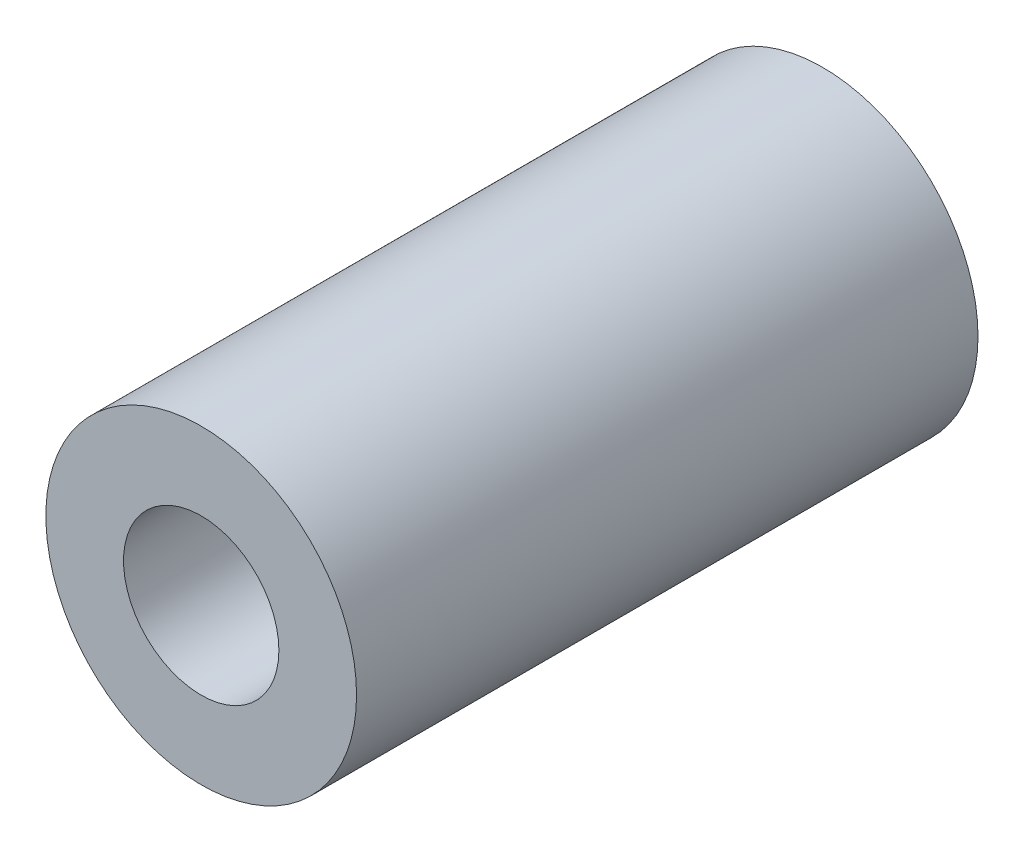
from build123d import *

# Parameters (mm, degrees)
SKETCH1_R               = 6.35
BOSS_EXTRUDE1_DEPTH     = 25.4
CUT_EXTRUDE1_DEPTH      = 27.940768363
CUT_EXTRUDE1_DEPTH_BACK = 27.940768363
SKETCH2_R               = 3.175


with BuildPart() as part:
    # Sketch1 → Boss-Extrude1 (new body)
    with BuildSketch(Plane.XY):
        Circle(SKETCH1_R)
    extrude(amount=BOSS_EXTRUDE1_DEPTH)

    # Sketch2 → Cut-Extrude1 (cut, two sides: drawn at the far end of the back side and taken through both)
    with BuildSketch(Plane.XY.offset(25.4).offset(-CUT_EXTRUDE1_DEPTH_BACK)):
        Circle(SKETCH2_R)
    extrude(amount=CUT_EXTRUDE1_DEPTH + CUT_EXTRUDE1_DEPTH_BACK, mode=Mode.SUBTRACT)


solid = part.part
